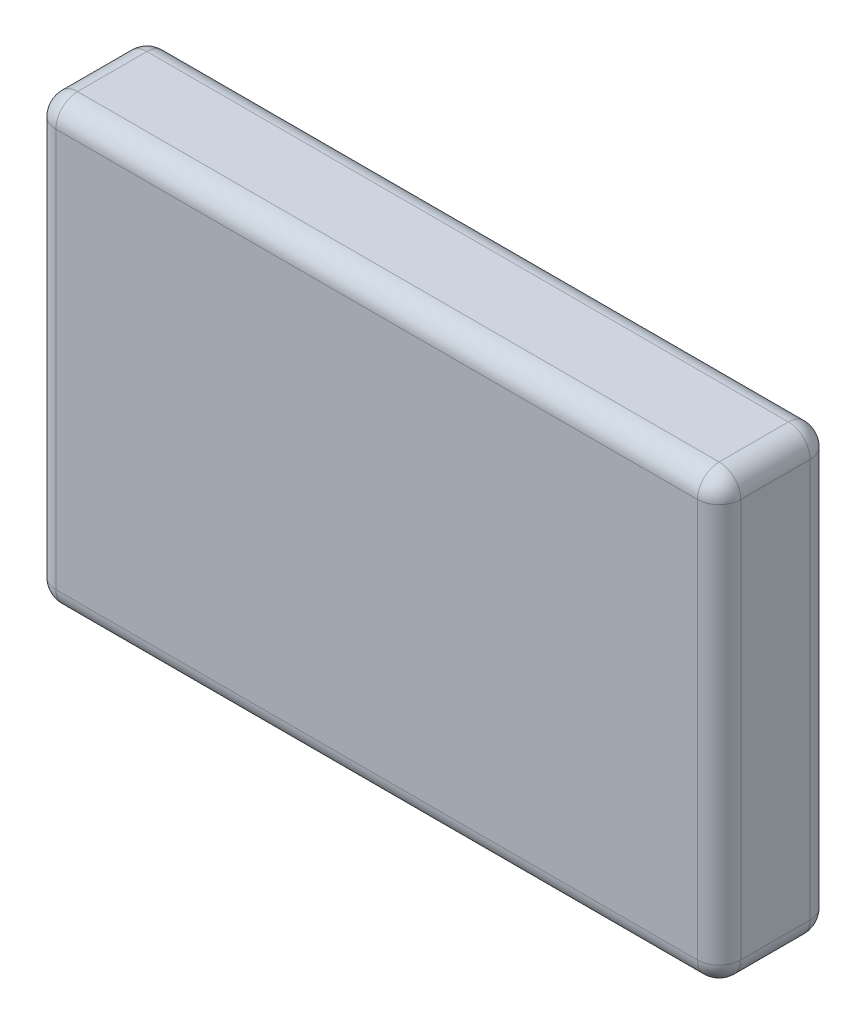
from build123d import *

# Parameters (mm, degrees)
ESQUISSE1_W        = 158
ESQUISSE1_H        = 102
BOSS_EXTRU_1_DEPTH = 26
CONG_1_R           = 5


with BuildPart() as part:
    # Esquisse1 → Boss.-Extru.1 (new body)
    with BuildSketch(Plane.XY):
        with Locations((-79, 51)):
            Rectangle(ESQUISSE1_W, ESQUISSE1_H)
    extrude(amount=BOSS_EXTRU_1_DEPTH)

    # Congé1
    cong_1_edges = [part.edges().sort_by_distance(p)[0] for p in [
        (-158, 51, 26),
        (-79, 0, 26),
        (0, 51, 26),
        (-79, 0, 0),
        (-158, 51, 0),
        (-79, 102, 0),
        (0, 51, 0),
        (-79, 102, 26),
        (0, 0, 13),
        (-158, 0, 13),
        (-158, 102, 13),
        (0, 102, 13),
    ]]
    fillet(cong_1_edges, radius=CONG_1_R)


solid = part.part
